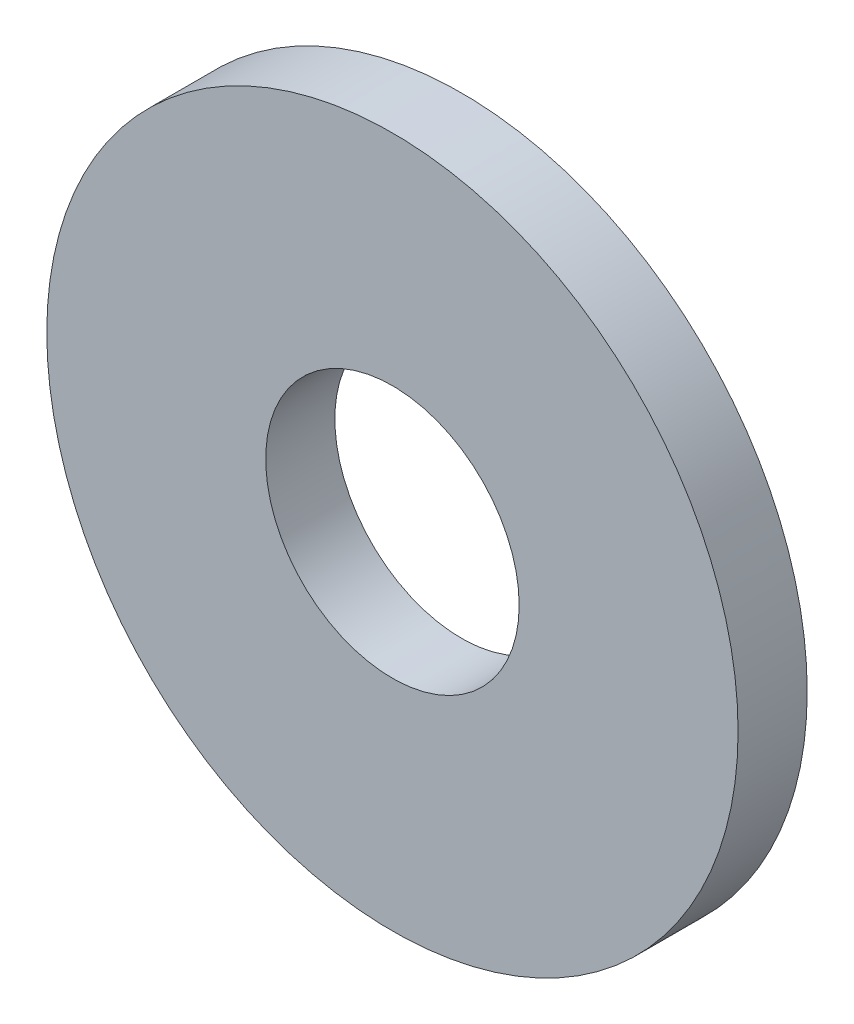
from build123d import *

# Parameters (mm, degrees)
SKETCH1_R           = 15
SKETCH1_R_2         = 5.5
BOSS_EXTRUDE1_DEPTH = 3


with BuildPart() as part:
    # Sketch1 → Boss-Extrude1 (new body)
    with BuildSketch(Plane.XY):
        Circle(SKETCH1_R)
        Circle(SKETCH1_R_2, mode=Mode.SUBTRACT)
    extrude(amount=BOSS_EXTRUDE1_DEPTH)


solid = part.part
